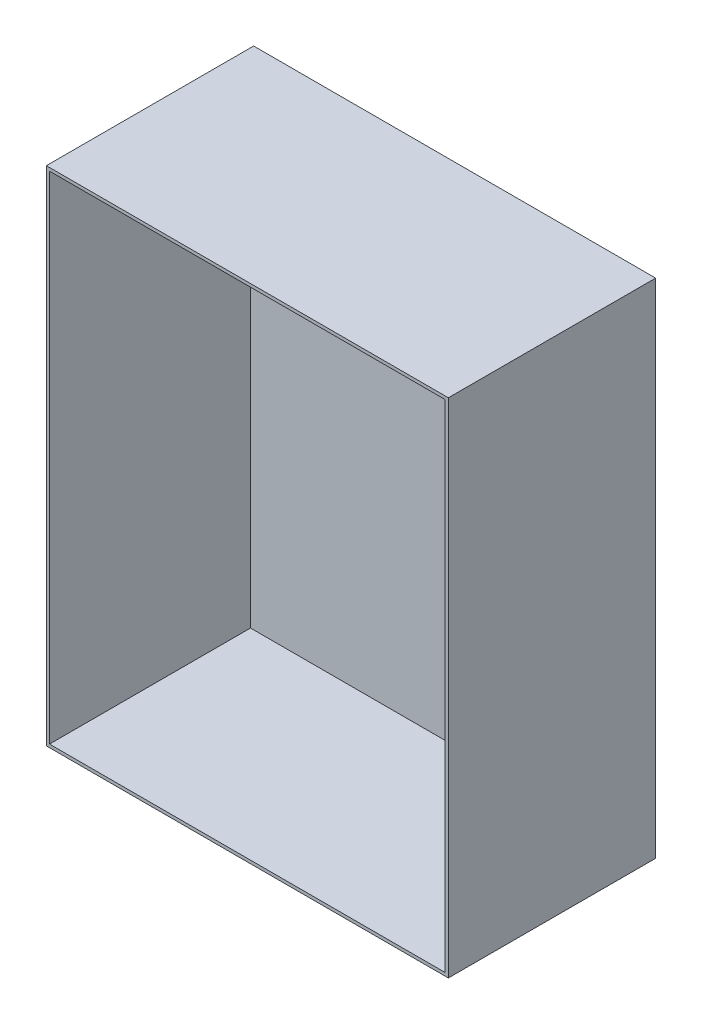
from build123d import *

# Parameters (mm, degrees)
SKETCH1_W           = 101.6
SKETCH1_H           = 127
BOSS_EXTRUDE1_DEPTH = 1.5875
SKETCH2_W           = 101.6
SKETCH2_H           = 127
SKETCH2_W_2         = 100.0125
SKETCH2_H_2         = 125.4125
EXTRUDE_THIN1_DEPTH = 50.8


with BuildPart() as part:
    # Sketch1 → Boss-Extrude1 (new body)
    with BuildSketch(Plane.XY):
        with Locations((-50.8, 63.5)):
            Rectangle(SKETCH1_W, SKETCH1_H)
    extrude(amount=BOSS_EXTRUDE1_DEPTH)

    # Sketch2 → Extrude-Thin1 (add)
    with BuildSketch(Plane.XY.offset(1.5875)):
        with Locations((-50.8, 63.5)):
            Rectangle(SKETCH2_W, SKETCH2_H)
        with Locations((-50.8, 63.5)):
            Rectangle(SKETCH2_W_2, SKETCH2_H_2, mode=Mode.SUBTRACT)
    extrude(amount=EXTRUDE_THIN1_DEPTH)


solid = part.part
